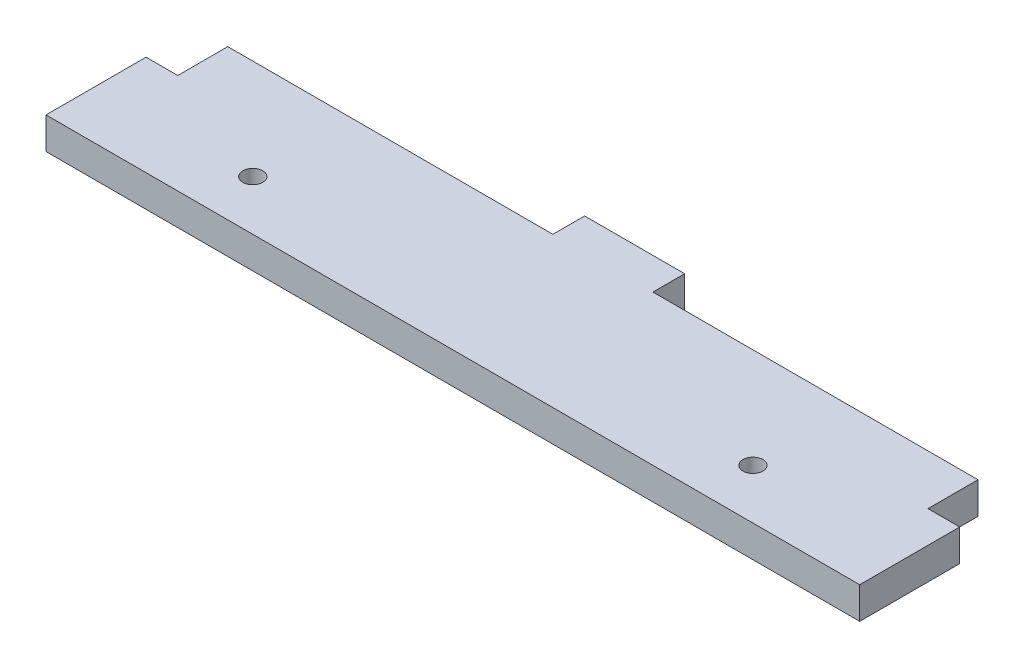
from build123d import *

# Parameters (mm, degrees)
SKETCH1_R           = 2
BOSS_EXTRUDE1_DEPTH = 3.175


with BuildPart() as part:
    # Sketch1 → Boss-Extrude1 (new, symmetric)
    with BuildSketch(Plane(origin=(0, 0, 0), x_dir=(1, 0, 0), z_dir=(0, 1, 0))):
        Polygon((-81.35, -18.175), (81.35, -18.175), (81.35, 1.825), (75, 1.825), (75, 11.825), (10, 11.825), (10, 18.175), (-10, 18.175), (-10, 11.825), (-75, 11.825), (-75, 1.825), (-81.35, 1.825), align=None)
        with Locations(Location((-50, -8.175, 0), (0, 0, 270))):
            Circle(SKETCH1_R, mode=Mode.SUBTRACT)
        with Locations(Location((50, -8.175, 0), (0, 0, 270))):
            Circle(SKETCH1_R, mode=Mode.SUBTRACT)
    extrude(amount=BOSS_EXTRUDE1_DEPTH, both=True)


solid = part.part
